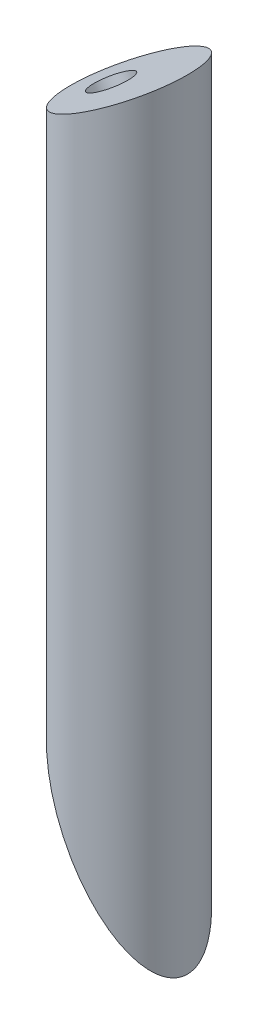
from build123d import *

# Parameters (mm, degrees)
SKETCH1_R           = 7.5
BOSS_EXTRUDE1_DEPTH = 100
CUT_EXTRUDE1_DEPTH  = 50
SKETCH3_R           = 2.5
CUT_EXTRUDE2_DEPTH  = 10
SKETCH4_R           = 2.5
CUT_EXTRUDE3_DEPTH  = 7


with BuildPart() as part:
    # Sketch1 → Boss-Extrude1 (new body)
    with BuildSketch(Plane(origin=(0, 0, 0), x_dir=(1, 0, 0), z_dir=(0, 1, 0))):
        with Locations(Location((0, 0, 0), (0, 0, 270))):
            Circle(SKETCH1_R)
    extrude(amount=BOSS_EXTRUDE1_DEPTH)

    # Sketch2 → Cut-Extrude1 (cut, symmetric)
    with BuildSketch(Plane.XY):
        Polygon((7.5, 0), (-11.156019953, 32.313174426), (-11.156019953, -9.986207202), (7.5, -9.986207202), align=None)
        Polygon((7.5, 100), (-22.60822249, 82.617009641), (-22.60822249, 113.40434485), (7.5, 113.40434485), align=None)
    extrude(amount=CUT_EXTRUDE1_DEPTH, both=True, mode=Mode.SUBTRACT)

    # Sketch3 → Cut-Extrude2 (cut)
    with BuildSketch(Plane(origin=(-41.426270189, 71.752404736, 0), x_dir=(0.8660254037844379, 0.5000000000000013, 0), z_dir=(-0.5000000000000013, 0.8660254037844379, 0))):
        with Locations(Location((45.174682453, 0, 0), (0, 0, 180))):
            Circle(SKETCH3_R)
    extrude(amount=-CUT_EXTRUDE2_DEPTH, mode=Mode.SUBTRACT)

    # Sketch4 → Cut-Extrude3 (cut)
    with BuildSketch(Plane(origin=(5.625, 3.247595264, 0), x_dir=(0, 0, 1), z_dir=(-0.8660254037844362, -0.5000000000000046, 0))):
        with Locations(Location((0, 18.25, 0), (0, 0, 270))):
            Circle(SKETCH4_R)
    extrude(amount=-CUT_EXTRUDE3_DEPTH, mode=Mode.SUBTRACT)


solid = part.part
